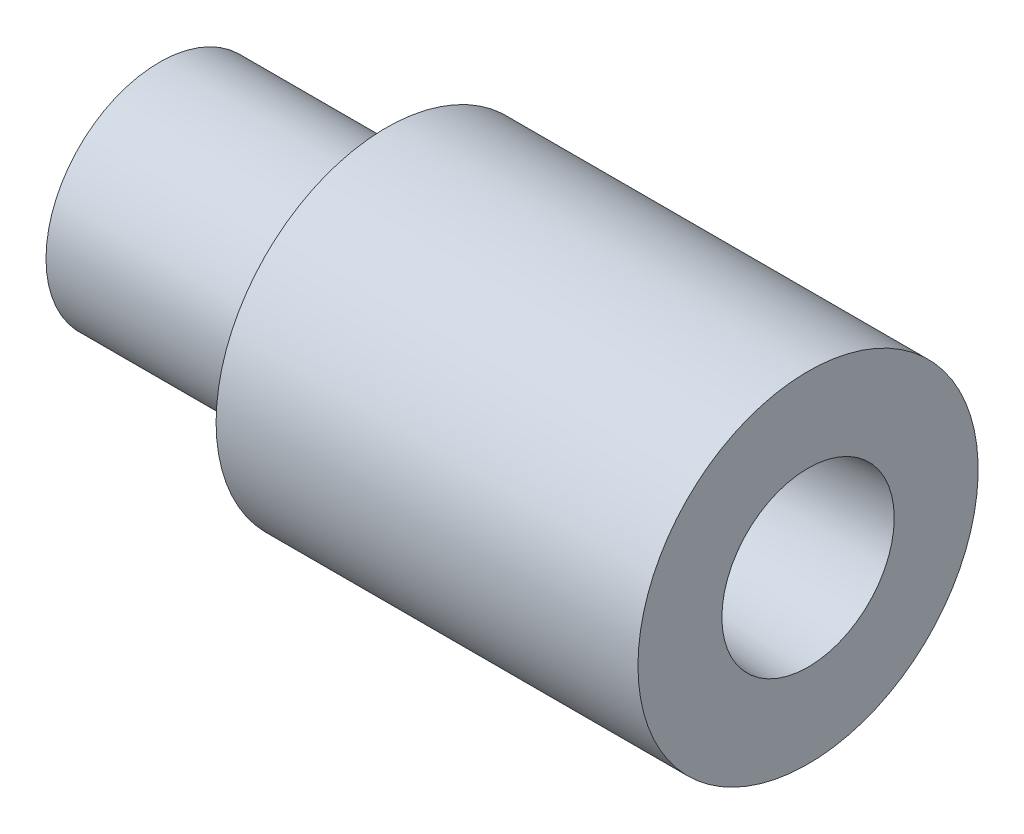
from build123d import *


with BuildPart() as part:
    # Sketch1 → Revolve1 (revolve)
    with BuildSketch(Plane(origin=(0, 0, 0), x_dir=(1, 0, 0), z_dir=(0, 1, 0)), mode=Mode.PRIVATE) as revolve1_sk:
        Polygon((0, 2.286), (0, 6.35), (12.7, 6.35), (12.7, 9.525), (36.323692292, 9.525), (36.323692292, 4.826), align=None)
    revolve(revolve1_sk.sketch.rotate(Axis((0, 0, 0), (1, 0, 0)), 180), axis=Axis((0, 0, 0), (1, 0, 0)))


solid = part.part
